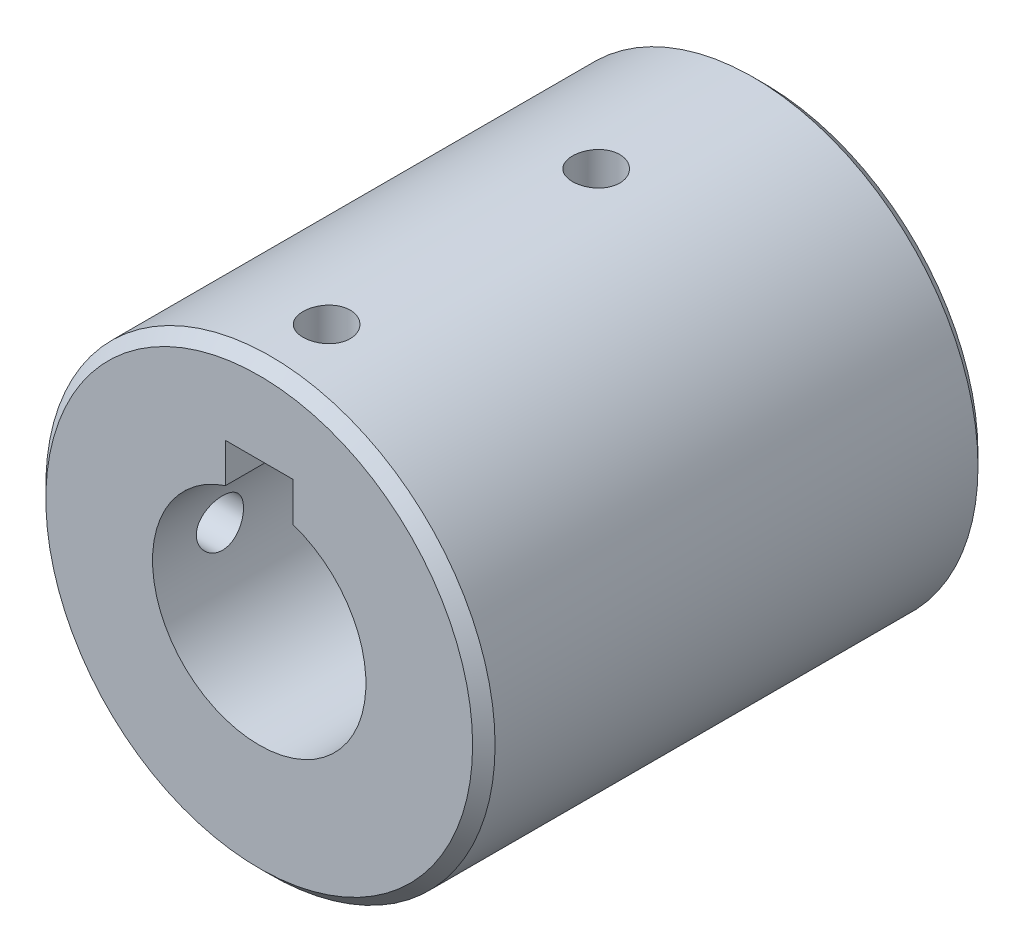
from build123d import *

# Parameters (mm, degrees)
SKETCH_1_R                  = 20
SKETCH_1_R_2                = 9.5
EXTRUDE_1_DEPTH             = 22.5
SKETCH_3_W                  = 6
SKETCH_3_H                  = 6
CUT_EXTRUDE_2_DEPTH         = 54.150729064
HOLE_WIZARD_M5_1_AT_2_COUNT = 2
HOLE_WIZARD_M5_1_AT_2_PITCH = 24
PATTERN_CIRCULAR_1_COUNT    = 2
PATTERN_CIRCULAR_1_ANGLE    = 90
CHAMFER_1_SIZE              = 1


with BuildPart() as part:
    # 草图1 → 凸台-拉伸1 (new, symmetric)
    with BuildSketch(Plane.XY):
        with Locations(Location((0, 0, 0), (0, 0, 180))):
            Circle(SKETCH_1_R)
        with Locations(Location((0, 0, 0), (0, 0, 180))):
            Circle(SKETCH_1_R_2, mode=Mode.SUBTRACT)
    extrude(amount=EXTRUDE_1_DEPTH, both=True)

    # 草图3 → 切除-拉伸2 (cut, through all)
    with BuildSketch(Plane(origin=(0, 0, -22.5), x_dir=(-1, 0, 0), z_dir=(0, 0, -1))):
        with Locations((0, 9.5)):
            Rectangle(SKETCH_3_W, SKETCH_3_H)
    extrude(amount=-CUT_EXTRUDE_2_DEPTH, mode=Mode.SUBTRACT)

    # 草图4 → M5 螺纹孔1 (revolve, cut)
    with BuildSketch(Plane(origin=(-20, 0, 16.5), x_dir=(0, 0, 1), z_dir=(0, 1, 0))):
        Polygon((0, 0), (0, 20.2618073), (2.1, 19), (2.1, 0), align=None)
    hole_wizard_m5_1 = revolve(axis=Axis((-26.35, 0, 16.5), (1, 0, 0)), mode=Mode.SUBTRACT)

    # M5 螺纹孔1 at 2: M5 螺纹孔1 ×2
    with Locations(*[(0, 0, -i * HOLE_WIZARD_M5_1_AT_2_PITCH) for i in range(1, HOLE_WIZARD_M5_1_AT_2_COUNT)]):
        add(hole_wizard_m5_1, mode=Mode.SUBTRACT)

    # 阵列(圆周)1: M5 螺纹孔1 ×2 about axis
    pattern_circular_1_axis = Axis((0, 0, 22.5), (0, 0, -1))
    for i in range(1, PATTERN_CIRCULAR_1_COUNT):
        add(hole_wizard_m5_1.rotate(pattern_circular_1_axis, i * PATTERN_CIRCULAR_1_ANGLE / (PATTERN_CIRCULAR_1_COUNT - 1)), mode=Mode.SUBTRACT)

    # 阵列(圆周)1 copy 1 sketch → 阵列(圆周)1 copy 1 (revolve, cut)
    with BuildSketch(Plane(origin=(0, 20, -7.5), x_dir=(0, 0, 1), z_dir=(1, 0, 0))):
        Polygon((0, 0), (0, 20.2618073), (2.1, 19), (2.1, 0), align=None)
    revolve(axis=Axis((0, 26.35, -7.5), (0, -1, 0)), mode=Mode.SUBTRACT)

    # 倒角1
    chamfer_1_edges = [part.edges().sort_by_distance(p)[0] for p in [
        (20, 0, -22.5),
        (20, 0, 22.5),
    ]]
    chamfer(chamfer_1_edges, length=CHAMFER_1_SIZE)


solid = part.part
